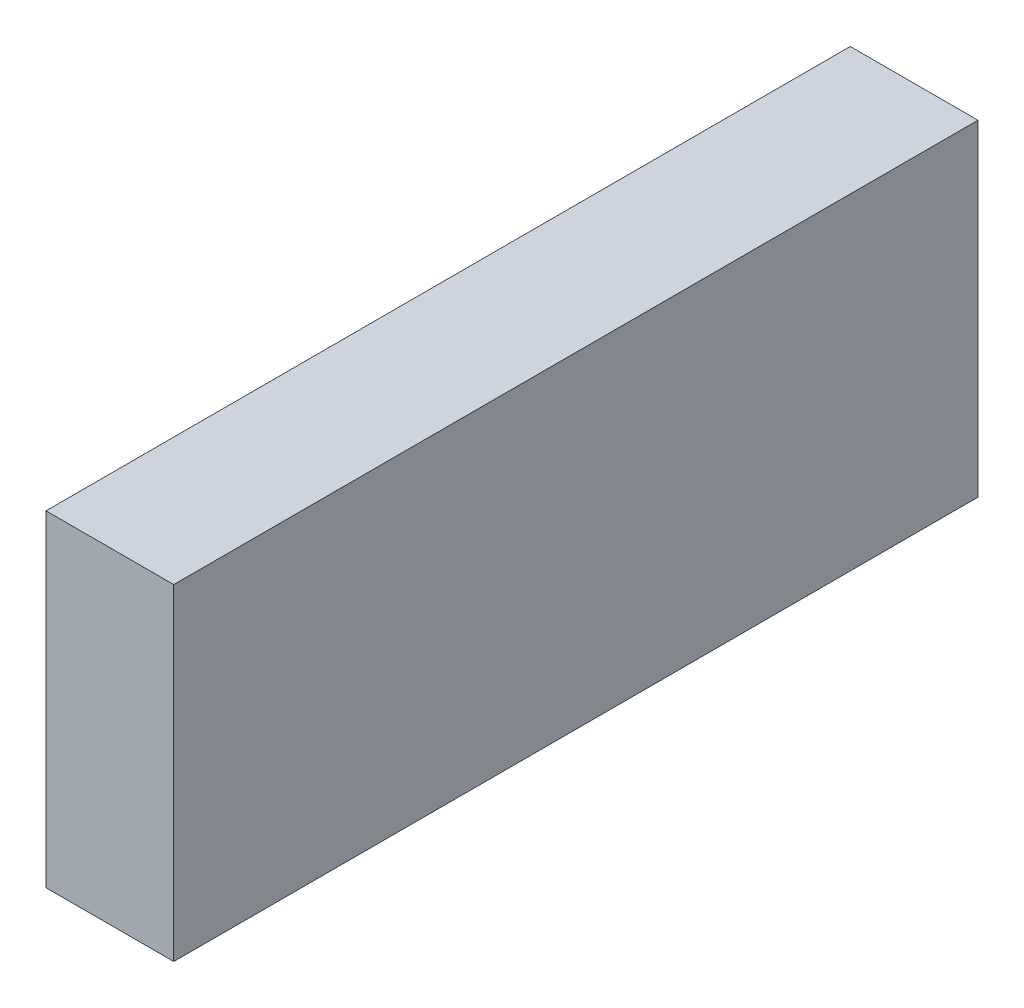
from build123d import *

# Parameters (mm, degrees)
SKETCH1_W           = 170
SKETCH1_H           = 69
BOSS_EXTRUDE1_DEPTH = 27


with BuildPart() as part:
    # Sketch1 → Boss-Extrude1 (new body)
    with BuildSketch(Plane(origin=(0, 0, 0), x_dir=(0, 0, -1), z_dir=(1, 0, 0))):
        Rectangle(SKETCH1_W, SKETCH1_H)
    extrude(amount=BOSS_EXTRUDE1_DEPTH)


solid = part.part
